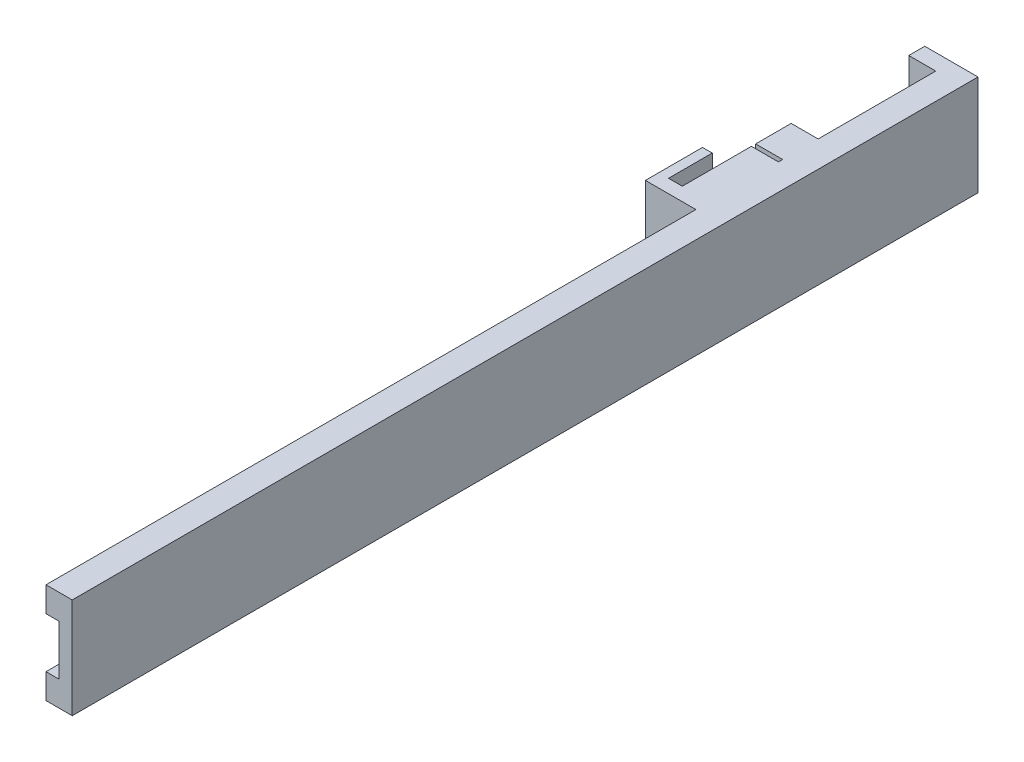
from build123d import *

# Parameters (mm, degrees)
BOSS_EXTRUDE1_DEPTH = 11.6586
SKETCH2_5_W         = 3.1369
SKETCH2_5_H         = 0.491550165
CUT_EXTRUDE2_DEPTH  = 79.458628588
CUT_EXTRUDE4_START  = 77.0734
SKETCH3_W           = 1.524
SKETCH3_H           = 5.8293
CUT_EXTRUDE4_DEPTH  = 25.4


with BuildPart() as part:
    # Sketch2 → Boss-Extrude1 (new body)
    with BuildSketch(Plane(origin=(0, 0, 0), x_dir=(1, 0, 0), z_dir=(0, 1, 0))):
        Polygon((0, 5.08), (0, -1.556064247), (5.869646797, -1.556064247), (5.869646797, -77.07340022), (8.917646797, -77.07340022), (8.917646797, 28.173908926), (2.732746797, 28.173908926), (2.732746797, 26.3144), (5.869646797, 26.3144), (5.869646797, 12.6492), (2.732746797, 12.6492), (2.732746797, 0), (1.132546797, 0), (1.132546797, 5.08), align=None)
    extrude(amount=BOSS_EXTRUDE1_DEPTH)

    # Sketch2<5> → Cut-Extrude2 (cut, through all)
    with BuildSketch(Plane(origin=(0, 0, 0), x_dir=(1, 0, 0), z_dir=(0, 1, 0))):
        with Locations((4.301196797, 8.275924918)):
            Rectangle(SKETCH2_5_W, SKETCH2_5_H)
    extrude(amount=CUT_EXTRUDE2_DEPTH, mode=Mode.SUBTRACT)

    # Sketch3 → Cut-Extrude4 (cut)
    with BuildSketch(Plane.XY.offset(CUT_EXTRUDE4_START)):
        with Locations((6.631646797, 5.8293)):
            Rectangle(SKETCH3_W, SKETCH3_H)
    extrude(amount=-CUT_EXTRUDE4_DEPTH, mode=Mode.SUBTRACT)


solid = part.part
